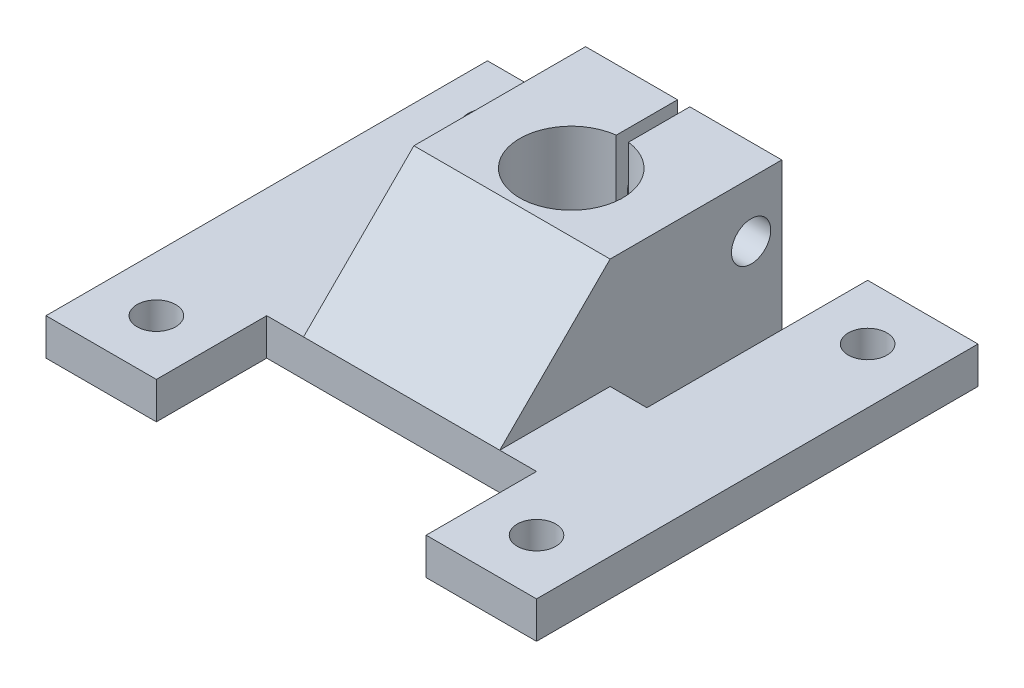
from build123d import *

# Parameters (mm, degrees)
SKETCH2_R           = 1.575
BOSS_EXTRUDE4_DEPTH = 3
BOSS_EXTRUDE5_DEPTH = 9
RIB2_REACH          = 44.895
SKETCH8_WALL_W      = 100.51836442
SKETCH8_WALL_H      = 16
SKETCH9_R           = 1.6
CUT_EXTRUDE1_DEPTH  = 48.15930449


with BuildPart() as part:
    # Sketch2 → Boss-Extrude4 (new body)
    # profile 1 of 4: a face of its own
    with BuildSketch(Plane(origin=(0, 0, 0), x_dir=(1, 0, 0), z_dir=(0, 1, 0))):
        Polygon((28, -18), (20, -18), (20, -27), (31, -27), (31, -36), (40, -36), (40, 0), (31, 0), (31, -18), align=None)
        with Locations(Location((35.5, -31.5, 0), (0, 0, 270))):
            Circle(SKETCH2_R, mode=Mode.SUBTRACT)
        with Locations(Location((35.5, -4.5, 0), (0, 0, 270))):
            Circle(SKETCH2_R, mode=Mode.SUBTRACT)
    # profile 2 of 4: a face of its own
    with BuildSketch(Plane(origin=(0, 0, 0), x_dir=(1, 0, 0), z_dir=(0, 1, 0))):
        Polygon((9, 0), (0, 0), (0, -36), (9, -36), (9, -27), (20, -27), (20, -18), (12, -18), (9, -18), align=None)
        with Locations(Location((4.5, -31.5, 0), (0, 0, 270))):
            Circle(SKETCH2_R, mode=Mode.SUBTRACT)
        with Locations(Location((4.5, -4.5, 0), (0, 0, 270))):
            Circle(SKETCH2_R, mode=Mode.SUBTRACT)
    # profile 3 of 4: a face of its own
    with BuildSketch(Plane(origin=(0, 0, 0), x_dir=(1, 0, 0), z_dir=(0, 1, 0))):
        with BuildLine():
            Line((20, -17.370131892), (20, -18))
            Line((20, -18), (28, -18))
            Line((28, -18), (28, -4))
            Line((28, -4), (20.5, -4))
            Line((20.5, -4), (20.5, -9))
            ThreePointArc((20.5, -9), (24.192526324, -13.420577547), (20, -17.370131892))
        make_face()
    # profile 4 of 4: a face of its own
    with BuildSketch(Plane(origin=(0, 0, 0), x_dir=(1, 0, 0), z_dir=(0, 1, 0))):
        with BuildLine():
            Line((12, -4), (12, -18))
            Line((12, -18), (20, -18))
            Line((20, -18), (20, -17.370131892))
            ThreePointArc((20, -17.370131892), (15.807473676, -13.420577547), (19.5, -9))
            Line((19.5, -9), (19.5, -4))
            Line((19.5, -4), (12, -4))
        make_face()
    extrude(amount=BOSS_EXTRUDE4_DEPTH)

    # Sketch6 → Boss-Extrude5 (add)
    with BuildSketch(Plane(origin=(0, 3, 0), x_dir=(1, 0, 0), z_dir=(0, 1, 0))):
        with BuildLine():
            Line((12, -18), (28, -18))
            Line((28, -18), (28, -4))
            Line((28, -4), (20.5, -4))
            Line((20.5, -4), (20.5, -9))
            ThreePointArc((20.5, -9), (20, -17.370131892), (19.5, -9))
            Line((19.5, -9), (19.5, -4))
            Line((19.5, -4), (12, -4))
            Line((12, -4), (12, -18))
        make_face()
    extrude(amount=BOSS_EXTRUDE5_DEPTH)

    # Sketch8 wall → Rib2 (add, up to next)
    with BuildSketch(Plane(origin=(20, 7.5, 22.5), x_dir=(0, -0.707106781187, 0.707106781187), z_dir=(0, 0.707106781187, 0.707106781187)), mode=Mode.PRIVATE) as rib2_sk1:
        Rectangle(SKETCH8_WALL_W, SKETCH8_WALL_H)
    rib2_tool1 = extrude(rib2_sk1.sketch, amount=-RIB2_REACH, mode=Mode.PRIVATE) - part.part
    add(rib2_tool1.solids().sort_by_distance((20, 7.5, 22.5))[0])

    # Sketch9 → Cut-Extrude1 (cut, through all)
    with BuildSketch(Plane.ZY.offset(-12)):
        with Locations((6.5, 7.5)):
            Circle(SKETCH9_R)
    extrude(amount=-CUT_EXTRUDE1_DEPTH, mode=Mode.SUBTRACT)


solid = part.part
